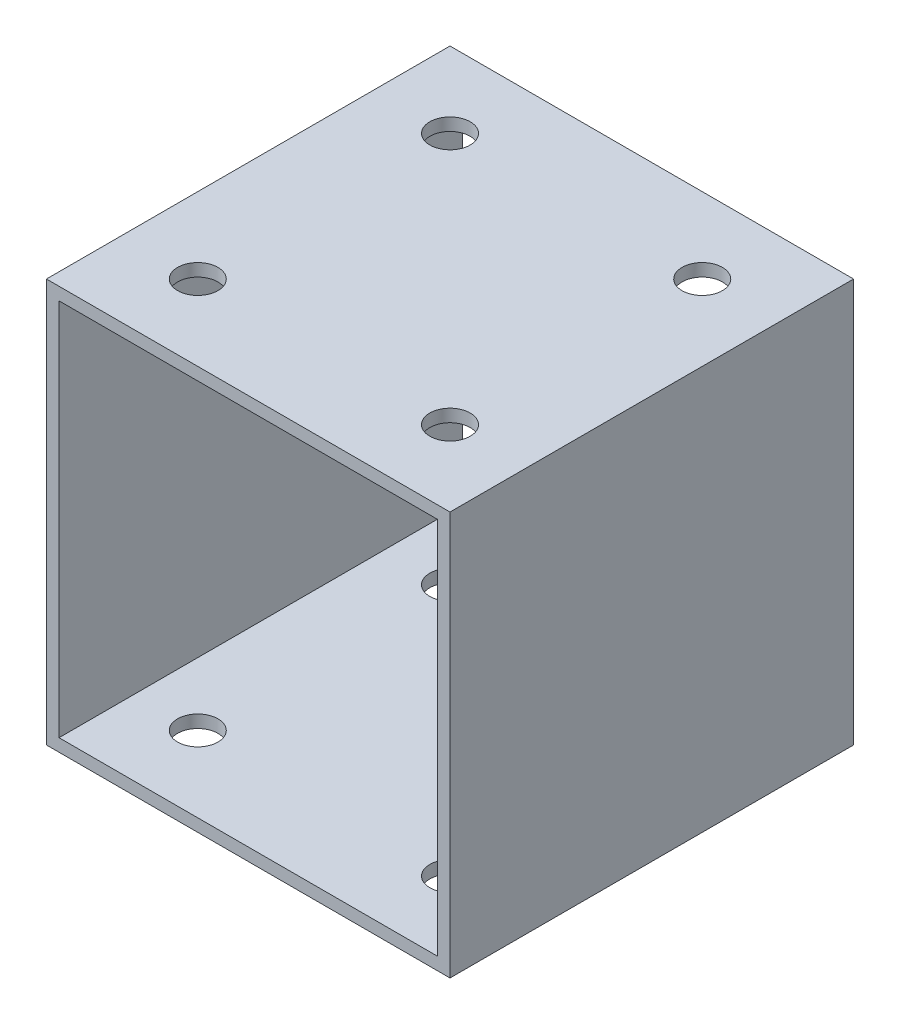
from build123d import *

# Parameters (mm, degrees)
SKETCH2_W           = 50.8
SKETCH2_H           = 50.8
SKETCH2_W_2         = 47.625
SKETCH2_H_2         = 47.625
BOSS_EXTRUDE1_DEPTH = 50.8
SKETCH3_R           = 2.54
CUT_EXTRUDE1_DEPTH  = 88.988181024


with BuildPart() as part:
    # Sketch2 → Boss-Extrude1 (new body)
    with BuildSketch(Plane.XY):
        with Locations((25.4, 25.4)):
            Rectangle(SKETCH2_W, SKETCH2_H)
        with Locations((25.4, 25.4)):
            Rectangle(SKETCH2_W_2, SKETCH2_H_2, mode=Mode.SUBTRACT)
    extrude(amount=BOSS_EXTRUDE1_DEPTH)

    # Sketch3 → Cut-Extrude1 (cut, through all)
    with BuildSketch(Plane(origin=(0, 50.8, 0), x_dir=(1, 0, 0), z_dir=(0, 1, 0))):
        with Locations(Location((41.275, -9.525, 0), (0, 0, 270))):
            Circle(SKETCH3_R)
        with Locations(Location((41.275, -41.275, 0), (0, 0, 270))):
            Circle(SKETCH3_R)
        with Locations(Location((9.525, -9.525, 0), (0, 0, 270))):
            Circle(SKETCH3_R)
        with Locations(Location((9.525, -41.275, 0), (0, 0, 270))):
            Circle(SKETCH3_R)
    extrude(amount=-CUT_EXTRUDE1_DEPTH, mode=Mode.SUBTRACT)


solid = part.part
